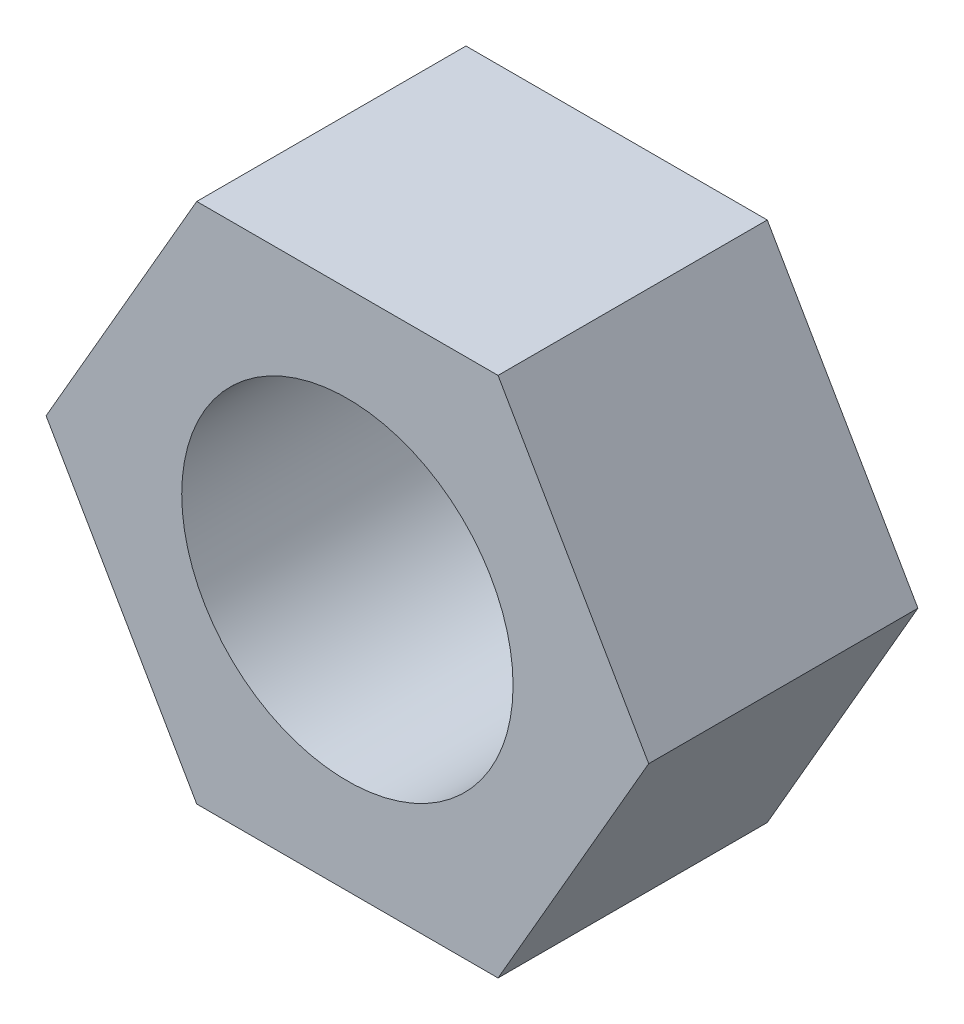
from build123d import *

# Parameters (mm, degrees)
SKETCH1_R           = 4
BOSS_EXTRUDE1_DEPTH = 6.5


with BuildPart() as part:
    # Sketch1 → Boss-Extrude1 (new body)
    with BuildSketch(Plane.XY):
        Polygon((7.274613392, 260), (3.637306696, 266.3), (-3.637306696, 266.3), (-7.274613392, 260), (-3.637306696, 253.7), (3.637306696, 253.7), align=None)
        with Locations(Location((0, 260, 0), (0, 0, 180))):
            Circle(SKETCH1_R, mode=Mode.SUBTRACT)
    extrude(amount=BOSS_EXTRUDE1_DEPTH)


solid = part.part
